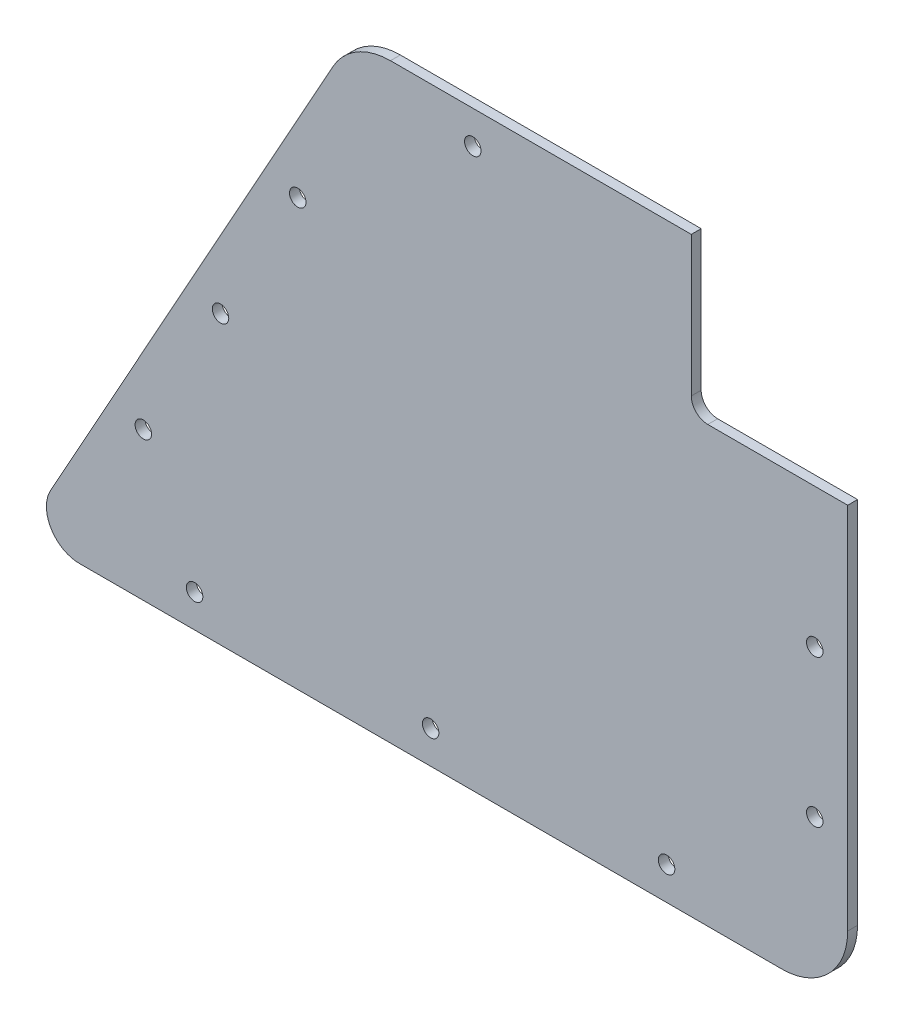
from build123d import *

# Parameters (mm, degrees)
BOSS_EXTRUDE1_DEPTH = 3
CUT_EXTRUDE1_REACH  = 245.11
SKETCH2_R           = 2.5
CUT_EXTRUDE2_DEPTH  = 244.110466883


with BuildPart() as part:
    # Sketch1 → Boss-Extrude1 (new body)
    with BuildSketch(Plane.XY):
        with BuildLine():
            Line((-59.436088262, 179.5), (59.436088262, 179.5))
            ThreePointArc((59.436088262, 179.5), (73.578223886, 173.642135624), (79.436088262, 159.5))
            Line((79.436088262, 159.5), (79.436088262, 20))
            ThreePointArc((79.436088262, 20), (73.578223886, 5.857864376), (59.436088262, 0))
            Line((59.436088262, 0), (-153.931232863, 0))
            ThreePointArc((-153.931232863, 0), (-162.549941964, 4.928722701), (-162.672805625, 14.856429312))
            Line((-162.672805625, 14.856429312), (-76.919233785, 169.212858624))
            ThreePointArc((-76.919233785, 169.212858624), (-69.57864286, 176.737418201), (-59.436088262, 179.5))
        make_face()
    extrude(amount=BOSS_EXTRUDE1_DEPTH)

    # Sketch2 → Cut-Extrude1 (cut, up to next)
    with BuildSketch(Plane.XY.offset(3), mode=Mode.PRIVATE) as cut_extrude1_sk1:
        with Locations((-34.436088262, 169.5)):
            Circle(SKETCH2_R)
    cut_extrude1_tool1 = extrude(cut_extrude1_sk1.sketch, amount=-CUT_EXTRUDE1_REACH, mode=Mode.PRIVATE) & part.part
    # Sketch2 → Cut-Extrude1 (cut, up to next)
    with BuildSketch(Plane.XY.offset(3), mode=Mode.PRIVATE) as cut_extrude1_sk2:
        with Locations((34.433911738, 169.5)):
            Circle(SKETCH2_R)
    cut_extrude1_tool2 = extrude(cut_extrude1_sk2.sketch, amount=-CUT_EXTRUDE1_REACH, mode=Mode.PRIVATE) & part.part
    # Sketch2 → Cut-Extrude1 (cut, up to next)
    with BuildSketch(Plane.XY.offset(3), mode=Mode.PRIVATE) as cut_extrude1_sk3:
        with Locations((69.436088262, 134.5)):
            Circle(SKETCH2_R)
    cut_extrude1_tool3 = extrude(cut_extrude1_sk3.sketch, amount=-CUT_EXTRUDE1_REACH, mode=Mode.PRIVATE) & part.part
    # Sketch2 → Cut-Extrude1 (cut, up to next)
    with BuildSketch(Plane.XY.offset(3), mode=Mode.PRIVATE) as cut_extrude1_sk4:
        with Locations((69.436088262, 89.75)):
            Circle(SKETCH2_R)
    cut_extrude1_tool4 = extrude(cut_extrude1_sk4.sketch, amount=-CUT_EXTRUDE1_REACH, mode=Mode.PRIVATE) & part.part
    # Sketch2 → Cut-Extrude1 (cut, up to next)
    with BuildSketch(Plane.XY.offset(3), mode=Mode.PRIVATE) as cut_extrude1_sk5:
        with Locations((69.436088262, 45)):
            Circle(SKETCH2_R)
    cut_extrude1_tool5 = extrude(cut_extrude1_sk5.sketch, amount=-CUT_EXTRUDE1_REACH, mode=Mode.PRIVATE) & part.part
    # Sketch2 → Cut-Extrude1 (cut, up to next)
    with BuildSketch(Plane.XY.offset(3), mode=Mode.PRIVATE) as cut_extrude1_sk6:
        with Locations((24.436088262, 10)):
            Circle(SKETCH2_R)
    cut_extrude1_tool6 = extrude(cut_extrude1_sk6.sketch, amount=-CUT_EXTRUDE1_REACH, mode=Mode.PRIVATE) & part.part
    # Sketch2 → Cut-Extrude1 (cut, up to next)
    with BuildSketch(Plane.XY.offset(3), mode=Mode.PRIVATE) as cut_extrude1_sk7:
        with Locations((-47.243911738, 10)):
            Circle(SKETCH2_R)
    cut_extrude1_tool7 = extrude(cut_extrude1_sk7.sketch, amount=-CUT_EXTRUDE1_REACH, mode=Mode.PRIVATE) & part.part
    # Sketch2 → Cut-Extrude1 (cut, up to next)
    with BuildSketch(Plane.XY.offset(3), mode=Mode.PRIVATE) as cut_extrude1_sk8:
        with Locations((-118.923911738, 10)):
            Circle(SKETCH2_R)
    cut_extrude1_tool8 = extrude(cut_extrude1_sk8.sketch, amount=-CUT_EXTRUDE1_REACH, mode=Mode.PRIVATE) & part.part
    # Sketch2 → Cut-Extrude1 (cut, up to next)
    with BuildSketch(Plane.XY.offset(3), mode=Mode.PRIVATE) as cut_extrude1_sk9:
        with Locations((-134.505515616, 44.966291045)):
            Circle(SKETCH2_R)
    cut_extrude1_tool9 = extrude(cut_extrude1_sk9.sketch, amount=-CUT_EXTRUDE1_REACH, mode=Mode.PRIVATE) & part.part
    # Sketch2 → Cut-Extrude1 (cut, up to next)
    with BuildSketch(Plane.XY.offset(3), mode=Mode.PRIVATE) as cut_extrude1_sk10:
        with Locations((-87.602121323, 129.392400773)):
            Circle(SKETCH2_R)
    cut_extrude1_tool10 = extrude(cut_extrude1_sk10.sketch, amount=-CUT_EXTRUDE1_REACH, mode=Mode.PRIVATE) & part.part
    # Sketch2 → Cut-Extrude1 (cut, up to next)
    with BuildSketch(Plane.XY.offset(3), mode=Mode.PRIVATE) as cut_extrude1_sk11:
        with Locations((-111.05381847, 87.179345909)):
            Circle(SKETCH2_R)
    cut_extrude1_tool11 = extrude(cut_extrude1_sk11.sketch, amount=-CUT_EXTRUDE1_REACH, mode=Mode.PRIVATE) & part.part
    add(cut_extrude1_tool1.solids().sort_by_distance((-34.436088, 169.5, 3))[0], mode=Mode.SUBTRACT)
    add(cut_extrude1_tool2.solids().sort_by_distance((34.433912, 169.5, 3))[0], mode=Mode.SUBTRACT)
    add(cut_extrude1_tool3.solids().sort_by_distance((69.436088, 134.5, 3))[0], mode=Mode.SUBTRACT)
    add(cut_extrude1_tool4.solids().sort_by_distance((69.436088, 89.75, 3))[0], mode=Mode.SUBTRACT)
    add(cut_extrude1_tool5.solids().sort_by_distance((69.436088, 45, 3))[0], mode=Mode.SUBTRACT)
    add(cut_extrude1_tool6.solids().sort_by_distance((24.436088, 10, 3))[0], mode=Mode.SUBTRACT)
    add(cut_extrude1_tool7.solids().sort_by_distance((-47.243912, 10, 3))[0], mode=Mode.SUBTRACT)
    add(cut_extrude1_tool8.solids().sort_by_distance((-118.923912, 10, 3))[0], mode=Mode.SUBTRACT)
    add(cut_extrude1_tool9.solids().sort_by_distance((-134.505516, 44.966291, 3))[0], mode=Mode.SUBTRACT)
    add(cut_extrude1_tool10.solids().sort_by_distance((-87.602121, 129.392401, 3))[0], mode=Mode.SUBTRACT)
    add(cut_extrude1_tool11.solids().sort_by_distance((-111.053818, 87.179346, 3))[0], mode=Mode.SUBTRACT)

    # Sketch3 → Cut-Extrude2 (cut, through all)
    with BuildSketch(Plane.XY.offset(3)):
        with BuildLine():
            Line((31.933911738, 179.5), (31.933911738, 137))
            ThreePointArc((31.933911738, 137), (33.398377832, 133.464466094), (36.933911738, 132))
            Line((36.933911738, 132), (79.436088262, 132))
            Line((79.436088262, 132), (79.436088262, 159.5))
            ThreePointArc((79.436088262, 159.5), (73.578223886, 173.642135624), (59.436088262, 179.5))
            Line((59.436088262, 179.5), (31.933911738, 179.5))
        make_face()
    extrude(amount=-CUT_EXTRUDE2_DEPTH, mode=Mode.SUBTRACT)


solid = part.part
